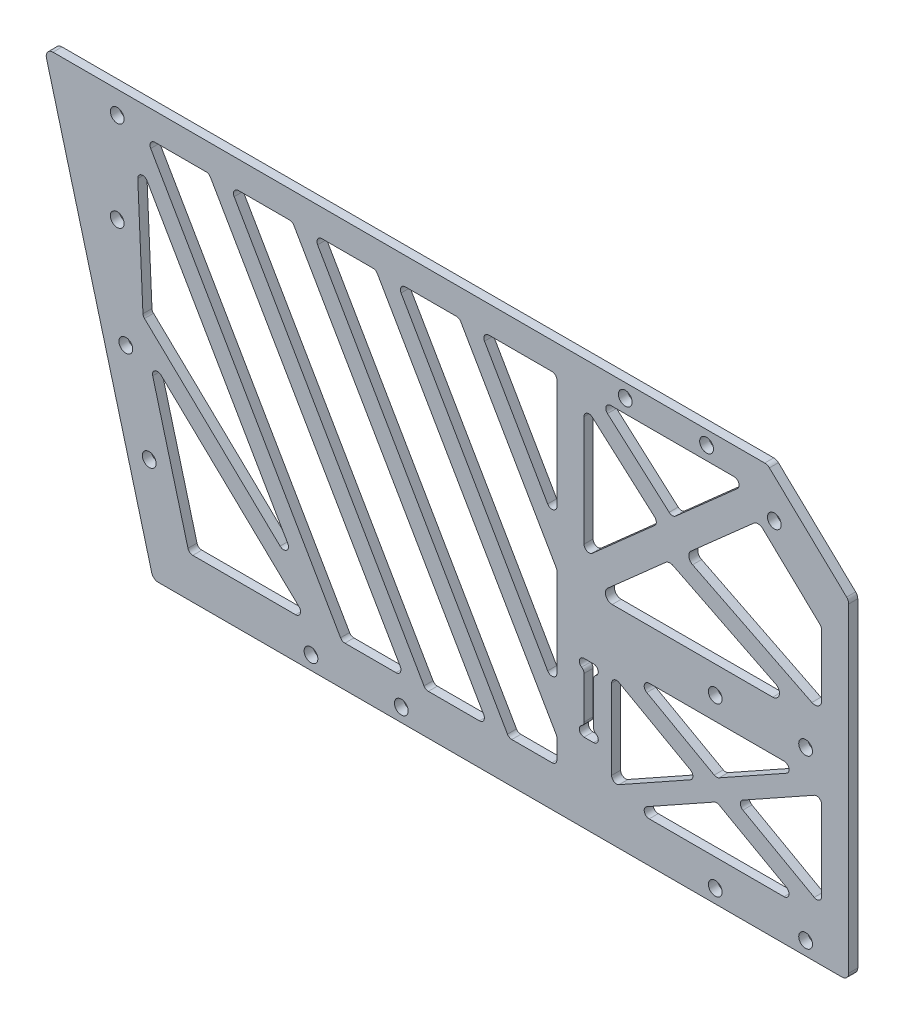
from build123d import *

# Parameters (mm, degrees)
EXTRUDE_1_DEPTH      = 2
CUT_EXTRUDE_1_DEPTH  = 2
SKETCH_3_R           = 1.525
CUT_EXTRUDE_2_DEPTH  = 10
SKETCH_4_W           = 2.1
SKETCH_4_H           = 15.1
CUT_EXTRUDE_4_DEPTH  = 2
SKETCH_5_R           = 1.05
CUT_EXTRUDE_5_DEPTH  = 2
SKETCH_6_R           = 1.05
CUT_EXTRUDE_6_DEPTH  = 2
SKETCH_7_R           = 1.525
CUT_EXTRUDE_7_DEPTH  = 10
SKETCH_8_R           = 1.525
CUT_EXTRUDE_8_DEPTH  = 2
CUT_EXTRUDE_9_DEPTH  = 22
EXTRUDE_2_DEPTH      = 2
FILLET_1_R           = 1.1
CUT_EXTRUDE_10_DEPTH = 22
FILLET_2_R           = 1.1
CUT_EXTRUDE_11_DEPTH = 2
EXTRUDE_3_DEPTH      = 2
FILLET_3_R           = 1.5
FILLET_4_R           = 1.5
CUT_EXTRUDE_12_DEPTH = 2
FILLET_5_R           = 1.1
SKETCH_16_R          = 1.525
CUT_EXTRUDE_13_DEPTH = 10


with BuildPart() as part:
    # 草图1 → 凸台-拉伸1 (new body)
    with BuildSketch(Plane.XY):
        Polygon((-24.115427319, 90), (0, 0), (154, 0), (154, 90), align=None)
    extrude(amount=EXTRUDE_1_DEPTH)

    # 草图2 → 切除-拉伸1 (cut)
    with BuildSketch(Plane(origin=(0, 0, 0), x_dir=(-1, 0, 0), z_dir=(0, 0, -1))):
        Polygon((-136, 90), (-154, 72.927151491), (-154, 90), align=None)
    extrude(amount=-CUT_EXTRUDE_1_DEPTH, mode=Mode.SUBTRACT)

    # 草图3 → 切除-拉伸2 (cut)
    with BuildSketch(Plane(origin=(0, 0, 0), x_dir=(-1, 0, 0), z_dir=(0, 0, -1))):
        with Locations((-137.525854154, 79.966858345)):
            Circle(SKETCH_3_R)
    extrude(amount=-CUT_EXTRUDE_2_DEPTH, mode=Mode.SUBTRACT)

    # 草图4 → 切除-拉伸4 (cut)
    with BuildSketch(Plane(origin=(0, 0, 0), x_dir=(-1, 0, 0), z_dir=(0, 0, -1))):
        with Locations((-96.450036, 25)):
            Rectangle(SKETCH_4_W, SKETCH_4_H)
    extrude(amount=-CUT_EXTRUDE_4_DEPTH, mode=Mode.SUBTRACT)

    # 草图5 → 切除-拉伸5 (cut)
    with BuildSketch(Plane(origin=(0, 0, 0), x_dir=(-1, 0, 0), z_dir=(0, 0, -1))):
        with Locations((-95.400036, 31.5)):
            Circle(SKETCH_5_R)
        with Locations((-95.400036, 18.5)):
            Circle(SKETCH_5_R)
    extrude(amount=-CUT_EXTRUDE_5_DEPTH, mode=Mode.SUBTRACT)

    # 草图6 → 切除-拉伸6 (cut)
    with BuildSketch(Plane(origin=(0, 0, 0), x_dir=(-1, 0, 0), z_dir=(0, 0, -1))):
        with Locations((-97.500036, 31.5)):
            Circle(SKETCH_6_R)
        with Locations((-97.500036, 18.5)):
            Circle(SKETCH_6_R)
    extrude(amount=-CUT_EXTRUDE_6_DEPTH, mode=Mode.SUBTRACT)

    # 草图7 → 切除-拉伸7 (cut)
    with BuildSketch(Plane(origin=(0, 0, 0), x_dir=(-1, 0, 0), z_dir=(0, 0, -1))):
        with Locations((-144.450036, 40)):
            Circle(SKETCH_7_R)
        with Locations((-124.450036, 40)):
            Circle(SKETCH_7_R)
        with Locations((-144.450036, 3)):
            Circle(SKETCH_7_R)
        with Locations((-124.450036, 3)):
            Circle(SKETCH_7_R)
        with Locations((-54.95, 3)):
            Circle(SKETCH_7_R)
        with Locations((-34.95, 3)):
            Circle(SKETCH_7_R)
        with Locations((0.864389861, 22.544463404)):
            Circle(SKETCH_7_R)
        with Locations((6.040770763, 41.86297993)):
            Circle(SKETCH_7_R)
    extrude(amount=-CUT_EXTRUDE_7_DEPTH, mode=Mode.SUBTRACT)

    # 草图8 → 切除-拉伸8 (cut)
    with BuildSketch(Plane(origin=(0, 0, 0), x_dir=(-1, 0, 0), z_dir=(0, 0, -1))):
        with Locations((7.940952255, 85)):
            Circle(SKETCH_8_R)
        with Locations((7.940952255, 65)):
            Circle(SKETCH_8_R)
    extrude(amount=-CUT_EXTRUDE_8_DEPTH, mode=Mode.SUBTRACT)

    # 草图9 → 切除-拉伸9 (cut)
    with BuildSketch(Plane.XY.offset(2)):
        Polygon((37.197841487, 9), (-3.598026147, 79.660515482), (-2.098925106, 46.470328188), (7.941219072, 9), align=None)
        Polygon((12.371779912, 84), (-1.484626548, 84), (41.816643641, 9), (55.673050101, 9), align=None)
        Polygon((30.846988526, 84), (16.990582066, 84), (60.291852255, 9), (74.148258715, 9), align=None)
        Polygon((49.32219714, 84), (35.46579068, 84), (78.767060869, 9), (89.400036, 9), (89.400036, 14.583146837), align=None)
        Polygon((67.797405754, 84), (53.940999294, 84), (89.400036, 22.583146837), (89.400036, 46.583146837), align=None)
        Polygon((89.400036, 84), (72.416207908, 84), (89.400036, 54.583146837), align=None)
    extrude(amount=-CUT_EXTRUDE_9_DEPTH, mode=Mode.SUBTRACT)

    # 草图10 → 凸台-拉伸2 (add)
    with BuildSketch(Plane.XY.offset(2)):
        Polygon((-3.479101205, 45.022877348), (35.817665388, 7.55254916), (38.578017586, 10.44745084), (-2.229360714, 49.358180398), align=None)
    extrude(amount=-EXTRUDE_2_DEPTH)

    # 圆角1
    fillet_1_edges = [part.edges().sort_by_distance(p)[0] for p in [
        (35.46579068, 84, 1),
        (49.32219714, 84, 1),
        (89.400036, 14.583146837, 1),
        (89.400036, 9, 1),
        (78.767060869, 9, 1),
        (53.940999294, 84, 1),
        (67.797405754, 84, 1),
        (89.400036, 46.583146837, 1),
        (89.400036, 22.583146837, 1),
        (12.371779912, 84, 1),
        (55.673050101, 9, 1),
        (41.816643641, 9, 1),
        (-1.484626548, 84, 1),
        (16.990582066, 84, 1),
        (30.846988526, 84, 1),
        (74.148258715, 9, 1),
        (60.291852255, 9, 1),
        (72.416207908, 84, 1),
        (89.400036, 84, 1),
        (89.400036, 54.583146837, 1),
        (-3.598026147, 79.660515482, 1),
        (7.941219072, 9, 1),
        (-1.104341602, 42.75849202, 1),
        (34.299660594, 9, 1),
        (33.648224986, 15.148116128, 1),
        (-2.229360714, 49.358180398, 1),
    ]]
    fillet(fillet_1_edges, radius=FILLET_1_R)

    # 草图12 → 切除-拉伸10 (cut)
    with BuildSketch(Plane(origin=(0, 0, 0), x_dir=(-1, 0, 0), z_dir=(0, 0, -1))):
        Polygon((-98.416316523, 84), (-131.525854154, 84), (-114.971085338, 69.335900219), align=None)
        Polygon((-95.400036, 81.328199563), (-111.954804815, 66.664099781), (-95.400036, 52), align=None)
    extrude(amount=-CUT_EXTRUDE_10_DEPTH, mode=Mode.SUBTRACT)

    # 圆角2
    fillet_2_edges = [part.edges().sort_by_distance(p)[0] for p in [
        (95.400036, 81.328199563, 1),
        (95.400036, 52, 1),
        (111.954804815, 66.664099781, 1),
        (98.416316523, 84, 1),
        (114.971085338, 69.335900219, 1),
        (131.525854154, 84, 1),
        (95.400036, 30.45, 1),
        (95.400036, 19.55, 1),
        (97.500036, 30.45, 1),
        (97.500036, 19.55, 1),
    ]]
    fillet(fillet_2_edges, radius=FILLET_2_R)

    # 草图13 → 切除-拉伸11 (cut)
    with BuildSketch(Plane(origin=(0, 0, 0), x_dir=(-1, 0, 0), z_dir=(0, 0, -1))):
        Polygon((-133.966239611, 78.146275258), (-148, 64.83537164), (-148, 46), (-97.675286665, 46), align=None)
    extrude(amount=-CUT_EXTRUDE_11_DEPTH, mode=Mode.SUBTRACT)

    # 草图14 → 凸台-拉伸3 (add)
    with BuildSketch(Plane.XY.offset(2)):
        with BuildLine():
            Line((114.927069111, 60.283916853), (147.106305973, 44.210779224))
            ThreePointArc((147.106305973, 44.210779224), (149.789220776, 45.106305973), (148.893694027, 47.789220776))
            Line((148.893694027, 47.789220776), (116.714457165, 63.862358405))
            ThreePointArc((116.714457165, 63.862358405), (114.031542362, 62.966831656), (114.927069111, 60.283916853))
        make_face()
    extrude(amount=-EXTRUDE_3_DEPTH)

    # 圆角3
    fillet_3_edges = [part.edges().sort_by_distance(p)[0] for p in [
        (148, 48.235610079, 1),
        (148, 64.83537164, 1),
        (114.323645335, 60.747001028, 1),
        (97.675286665, 46, 1),
        (143.524195219, 46, 1),
        (133.966239611, 78.146275258, 1),
        (117.434594693, 63.502658464, 1),
    ]]
    fillet(fillet_3_edges, radius=FILLET_3_R)

    # 圆角4
    fillet_4_edges = [part.edges().sort_by_distance(p)[0] for p in [
        (136, 90, 1),
        (154, 72.927151491, 1),
        (154, 0, 1),
        (0, 0, 1),
        (-24.115427319, 90, 1),
    ]]
    fillet(fillet_4_edges, radius=FILLET_4_R)

    # 草图15 → 切除-拉伸12 (cut)
    with BuildSketch(Plane(origin=(0, 0, 0), x_dir=(-1, 0, 0), z_dir=(0, 0, -1))):
        Polygon((-120.651925897, 22), (-101.500036, 11.291408111), (-101.500036, 32.708591889), align=None)
        Polygon((-143.901907897, 35), (-124.750018, 24.291408111), (-105.598128103, 35), align=None)
        Polygon((-148, 11.291408111), (-128.848110103, 22), (-148, 32.708591889), align=None)
        Polygon((-143.901907897, 9), (-105.598128103, 9), (-124.750018, 19.708591889), align=None)
    extrude(amount=-CUT_EXTRUDE_12_DEPTH, mode=Mode.SUBTRACT)

    # 圆角5
    fillet_5_edges = [part.edges().sort_by_distance(p)[0] for p in [
        (128.848110103, 22, 1),
        (148, 11.291408111, 1),
        (148, 32.708591889, 1),
        (105.598128103, 35, 1),
        (143.901907897, 35, 1),
        (124.750018, 24.291408111, 1),
        (105.598128103, 9, 1),
        (143.901907897, 9, 1),
        (124.750018, 19.708591889, 1),
        (101.500036, 32.708591889, 1),
        (101.500036, 11.291408111, 1),
        (120.651925897, 22, 1),
    ]]
    fillet(fillet_5_edges, radius=FILLET_5_R)

    # 草图16 → 切除-拉伸13 (cut)
    with BuildSketch(Plane(origin=(0, 0, 0), x_dir=(-1, 0, 0), z_dir=(0, 0, -1))):
        with Locations((-104.525854154, 87)):
            Circle(SKETCH_16_R)
        with Locations((-122.525854154, 87)):
            Circle(SKETCH_16_R)
    extrude(amount=-CUT_EXTRUDE_13_DEPTH, mode=Mode.SUBTRACT)


solid = part.part
